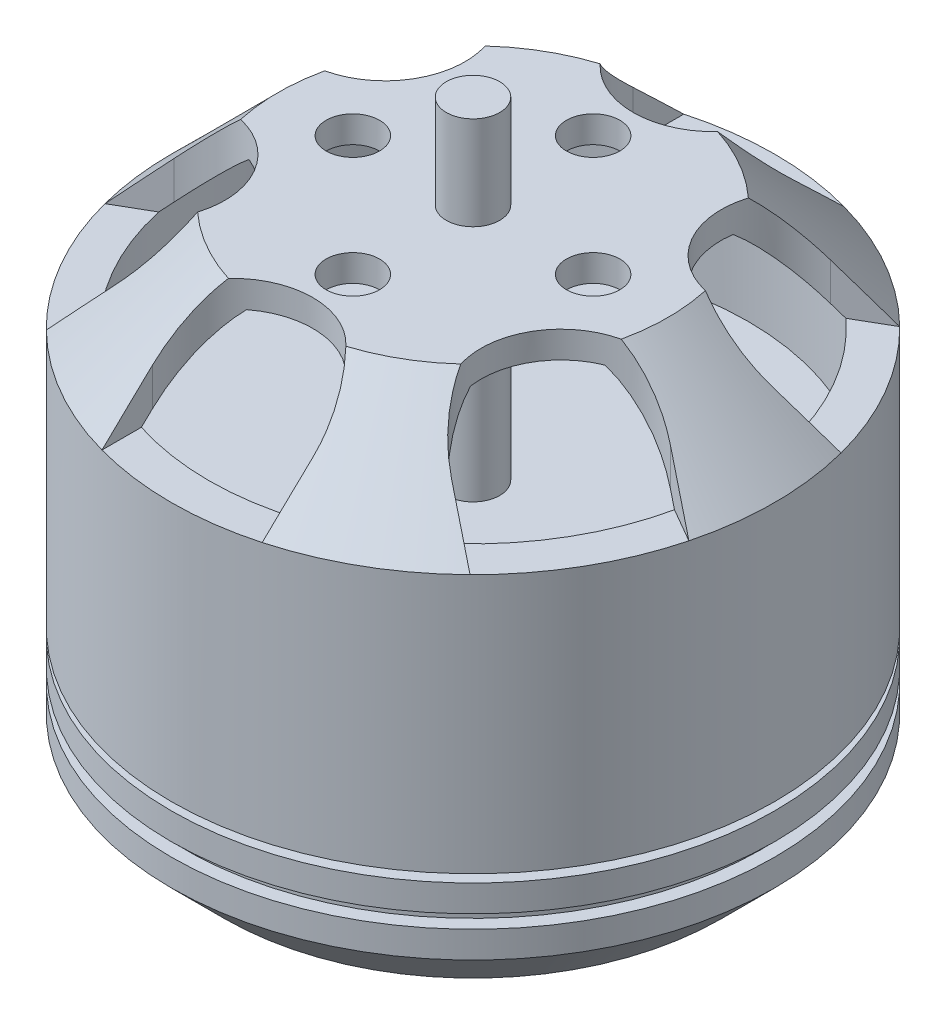
from build123d import *

# Parameters (mm, degrees)
SKETCH2_R          = 1
CUT_EXTRUDE1_DEPTH = 4
SKETCH3_R          = 1
CUT_EXTRUDE2_DEPTH = 3


with BuildPart() as part:
    # Sketch1 → Revolve1 (revolve)
    with BuildSketch(Plane.XY, mode=Mode.PRIVATE) as revolve1_sk:
        Polygon((0, 22), (0, -1.8), (1, -1.8), (1, 0), (9.3, 0), (11.3, 2), (11.3, 3), (10.8, 3), (10.8, 3.5), (11.3, 3.5), (11.3, 4.5), (9.3, 4.5), (9.3, 4.8), (11.3, 4.8), (11.3, 14.5), (7.3, 18.5), (1, 18.5), (1, 22), align=None)
        Polygon((2, 17.5), (6.885786438, 17.5), (10.3, 14.085786438), (10.3, 9.576431799), (1, 9.576431799), (1, 16.5), (2, 16.5), align=None, mode=Mode.SUBTRACT)
    revolve(revolve1_sk.sketch.rotate(Axis((0, 22, 0), (0, -1, 0)), 180), axis=Axis((0, 22, 0), (0, -1, 0)))

    # Sketch2 → Cut-Extrude1 (cut)
    with BuildSketch(Plane(origin=(0, 18.5, 0), x_dir=(1, 0, 0), z_dir=(0, 1, 0))):
        with Locations(Location((0, 4.5, 0), (0, 0, 180))):
            Circle(SKETCH2_R)
        with Locations(Location((4.5, 0, 0), (0, 0, 180))):
            Circle(SKETCH2_R)
        with Locations(Location((0, -4.5, 0), (0, 0, 180))):
            Circle(SKETCH2_R)
        with Locations(Location((-4.5, 0, 0), (0, 0, 180))):
            Circle(SKETCH2_R)
        with BuildLine():
            Line((-3, 9), (-3, 15.814579855))
            Line((-3, 15.814579855), (3, 15.814579855))
            Line((3, 15.814579855), (3, 9))
            ThreePointArc((3, 9), (0, 6), (-3, 9))
        make_face()
        with BuildLine():
            Line((6.294228634, 7.098076211), (12.195827905, 10.505366139))
            Line((12.195827905, 10.505366139), (15.195827905, 5.309213716))
            Line((15.195827905, 5.309213716), (9.294228634, 1.901923789))
            ThreePointArc((9.294228634, 1.901923789), (5.196152423, 3), (6.294228634, 7.098076211))
        make_face()
        with BuildLine():
            Line((9.294228634, -1.901923789), (15.195827905, -5.309213716))
            Line((15.195827905, -5.309213716), (12.195827905, -10.505366139))
            Line((12.195827905, -10.505366139), (6.294228634, -7.098076211))
            ThreePointArc((6.294228634, -7.098076211), (5.196152423, -3), (9.294228634, -1.901923789))
        make_face()
        with BuildLine():
            Line((3, -9), (3, -15.814579855))
            Line((3, -15.814579855), (-3, -15.814579855))
            Line((-3, -15.814579855), (-3, -9))
            ThreePointArc((-3, -9), (0, -6), (3, -9))
        make_face()
        with BuildLine():
            Line((-6.294228634, -7.098076211), (-12.195827905, -10.505366139))
            Line((-12.195827905, -10.505366139), (-15.195827905, -5.309213716))
            Line((-15.195827905, -5.309213716), (-9.294228634, -1.901923789))
            ThreePointArc((-9.294228634, -1.901923789), (-5.196152423, -3), (-6.294228634, -7.098076211))
        make_face()
        with BuildLine():
            Line((-9.294228634, 1.901923789), (-15.195827905, 5.309213716))
            Line((-15.195827905, 5.309213716), (-12.195827905, 10.505366139))
            Line((-12.195827905, 10.505366139), (-6.294228634, 7.098076211))
            ThreePointArc((-6.294228634, 7.098076211), (-5.196152423, 3), (-9.294228634, 1.901923789))
        make_face()
    extrude(amount=-CUT_EXTRUDE1_DEPTH, mode=Mode.SUBTRACT)

    # Sketch3 → Cut-Extrude2 (cut)
    with BuildSketch(Plane.XZ):
        with Locations((0, 6)):
            Circle(SKETCH3_R)
        with Locations((0, -6)):
            Circle(SKETCH3_R)
        with Locations((8, 0)):
            Circle(SKETCH3_R)
        with Locations((-8, 0)):
            Circle(SKETCH3_R)
    extrude(amount=-CUT_EXTRUDE2_DEPTH, mode=Mode.SUBTRACT)


solid = part.part
